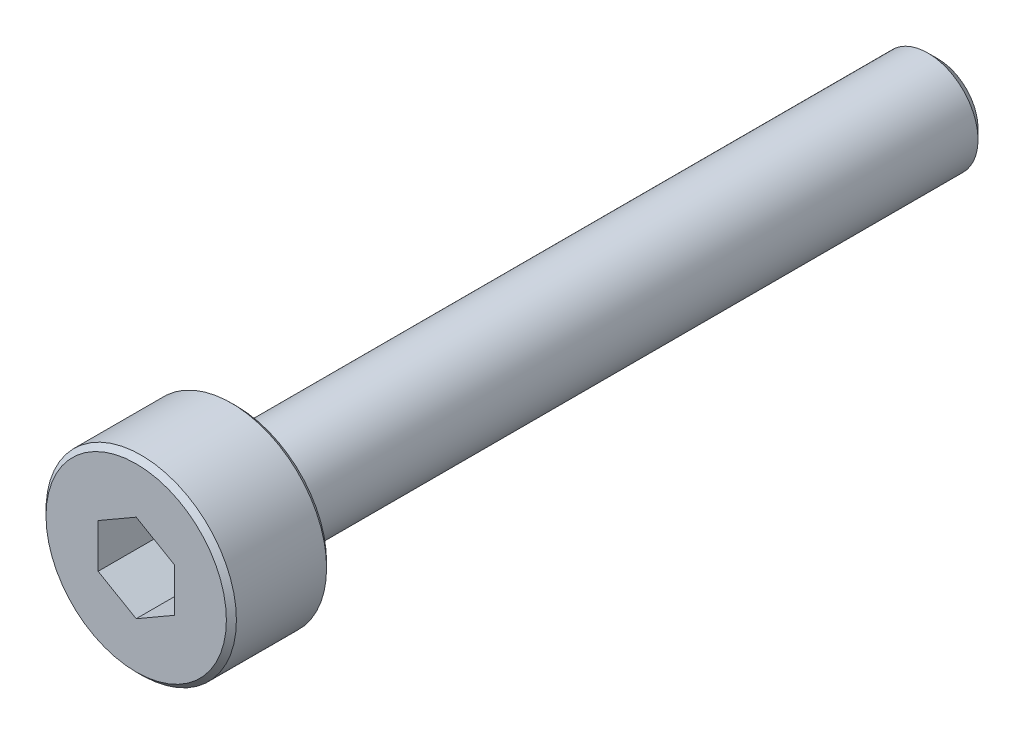
from build123d import *

# Parameters (mm, degrees)
SKETCH_1_W          = 1.9
SKETCH_1_H          = 2
SKETCH_2_R          = 1
EXTRUDE_1_DEPTH     = 14
CUT_EXTRUDE_1_DEPTH = 1.5
CHAMFER_1_SIZE2     = 0.100000822
CHAMFER_1_SIZE      = 0.100000763
CHAMFER_2_SIZE      = 0.200008364
CHAMFER_2_SIZE2     = 0.200010455


with BuildPart() as part:
    # 草图1 → 旋转1 (revolve)
    with BuildSketch(Plane(origin=(0, 0, 0), x_dir=(1, 0, 0), z_dir=(0, 1, 0))):
        with Locations((0.95, -11)):
            Rectangle(SKETCH_1_W, SKETCH_1_H)
    revolve(axis=Axis((0, 0, 10), (0, 0, 1)))

    # 草图2 → 凸台-拉伸1 (add)
    with BuildSketch(Plane(origin=(0, 0, 10), x_dir=(-1, 0, 0), z_dir=(0, 0, -1))):
        Circle(SKETCH_2_R)
    extrude(amount=EXTRUDE_1_DEPTH)

    # 草图3 → 切除-拉伸1 (cut)
    with BuildSketch(Plane.XY.offset(12)):
        Polygon((-0.76, -0.438786205), (0, -0.877572409), (0.76, -0.438786205), (0.76, 0.438786205), (0, 0.877572409), (-0.76, 0.438786205), align=None)
    extrude(amount=-CUT_EXTRUDE_1_DEPTH, mode=Mode.SUBTRACT)

    # 倒角1
    chamfer_1_edges = [part.edges().sort_by_distance(p)[0] for p in [
        (-1.9, 0, 12),
        (-1.9, 0, 10),
    ]]
    chamfer(chamfer_1_edges, length=CHAMFER_1_SIZE, length2=CHAMFER_1_SIZE2)

    # 倒角2
    chamfer_2_edges = [part.edges().sort_by_distance(p)[0] for p in [
        (1, 0, -4),
    ]]
    chamfer_2_side = [part.faces().sort_by_distance(p)[0] for p in [
        (1, 0, 3),
    ]]
    chamfer(chamfer_2_edges, length=CHAMFER_2_SIZE, length2=CHAMFER_2_SIZE2, reference=chamfer_2_side[0])


solid = part.part
